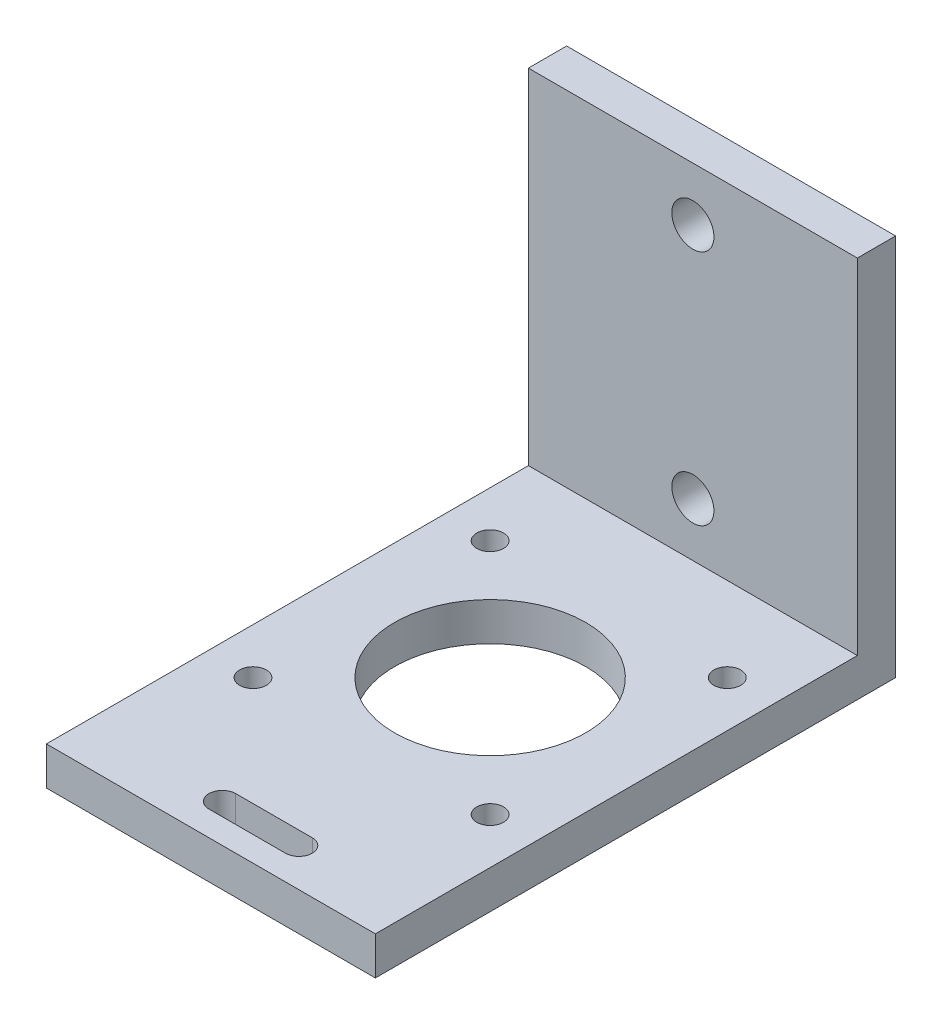
from build123d import *

# Parameters (mm, degrees)
SKETCH_1_W          = 43
SKETCH_1_H          = 43
SKETCH_1_R          = 1.75
SKETCH_1_R_2        = 12.5
EXTRUDE_1_DEPTH     = 5
SKETCH_3_W          = 43
SKETCH_3_H          = 5
EXTRUDE_2_DEPTH     = 5
SKETCH_4_W          = 43
SKETCH_4_H          = 50
EXTRUDE_3_DEPTH     = 5
SKETCH_5_R          = 2.75
CUT_EXTRUDE_1_DEPTH = 79.056311978
SKETCH_6_W          = 43
SKETCH_6_H          = 5
EXTRUDE_4_DEPTH     = 15
CUT_EXTRUDE_2_DEPTH = 72.979728546


with BuildPart() as part:
    # 草图1 → 凸台-拉伸1 (new body)
    with BuildSketch(Plane(origin=(0, 0, 0), x_dir=(1, 0, 0), z_dir=(0, 1, 0))):
        with Locations((-14.399691358, 11.712191358)):
            Rectangle(SKETCH_1_W, SKETCH_1_H)
        with Locations(Location((1.100308642, 27.212191358, 0), (0, 0, 270))):
            Circle(SKETCH_1_R, mode=Mode.SUBTRACT)
        with Locations(Location((-29.899691358, 27.212191358, 0), (0, 0, 270))):
            Circle(SKETCH_1_R, mode=Mode.SUBTRACT)
        with Locations(Location((-29.899691358, -3.787808642, 0), (0, 0, 270))):
            Circle(SKETCH_1_R, mode=Mode.SUBTRACT)
        with Locations(Location((1.100308642, -3.787808642, 0), (0, 0, 270))):
            Circle(SKETCH_1_R, mode=Mode.SUBTRACT)
        with Locations(Location((-14.399691358, 11.712191358, 0), (0, 0, 270))):
            Circle(SKETCH_1_R_2, mode=Mode.SUBTRACT)
    extrude(amount=EXTRUDE_1_DEPTH)

    # 草图3 → 凸台-拉伸2 (add)
    with BuildSketch(Plane(origin=(0, 0, -33.212191358), x_dir=(-1, 0, 0), z_dir=(0, 0, -1))):
        with Locations((14.399691358, 2.5)):
            Rectangle(SKETCH_3_W, SKETCH_3_H)
    extrude(amount=EXTRUDE_2_DEPTH)

    # 草图4 → 凸台-拉伸3 (add)
    with BuildSketch(Plane(origin=(0, 0, -38.212191358), x_dir=(-1, 0, 0), z_dir=(0, 0, -1))):
        with Locations((14.399691358, 25)):
            Rectangle(SKETCH_4_W, SKETCH_4_H)
    extrude(amount=EXTRUDE_3_DEPTH)

    # 草图5 → 切除-拉伸1 (cut, through all)
    with BuildSketch(Plane.XY.offset(-38.212191358)):
        with Locations((-14.399691358, 43)):
            Circle(SKETCH_5_R)
        with Locations((-14.399691358, 12)):
            Circle(SKETCH_5_R)
    extrude(amount=-CUT_EXTRUDE_1_DEPTH, mode=Mode.SUBTRACT)

    # 草图6 → 凸台-拉伸4 (add)
    with BuildSketch(Plane.XY.offset(9.787808642)):
        with Locations((-14.399691358, 2.5)):
            Rectangle(SKETCH_6_W, SKETCH_6_H)
    extrude(amount=EXTRUDE_4_DEPTH)

    # 草图7 → 切除-拉伸2 (cut, through all)
    with BuildSketch(Plane(origin=(0, 5, 0), x_dir=(1, 0, 0), z_dir=(0, 1, 0))):
        with BuildLine():
            Line((-17.899691358, -18.037808642), (-7.899691358, -18.037808642))
            ThreePointArc((-7.899691358, -18.037808642), (-6.149691358, -19.787808642), (-7.899691358, -21.537808642))
            Line((-7.899691358, -21.537808642), (-17.899691358, -21.537808642))
            ThreePointArc((-17.899691358, -21.537808642), (-19.649691358, -19.787808642), (-17.899691358, -18.037808642))
        make_face()
    extrude(amount=-CUT_EXTRUDE_2_DEPTH, mode=Mode.SUBTRACT)


solid = part.part
